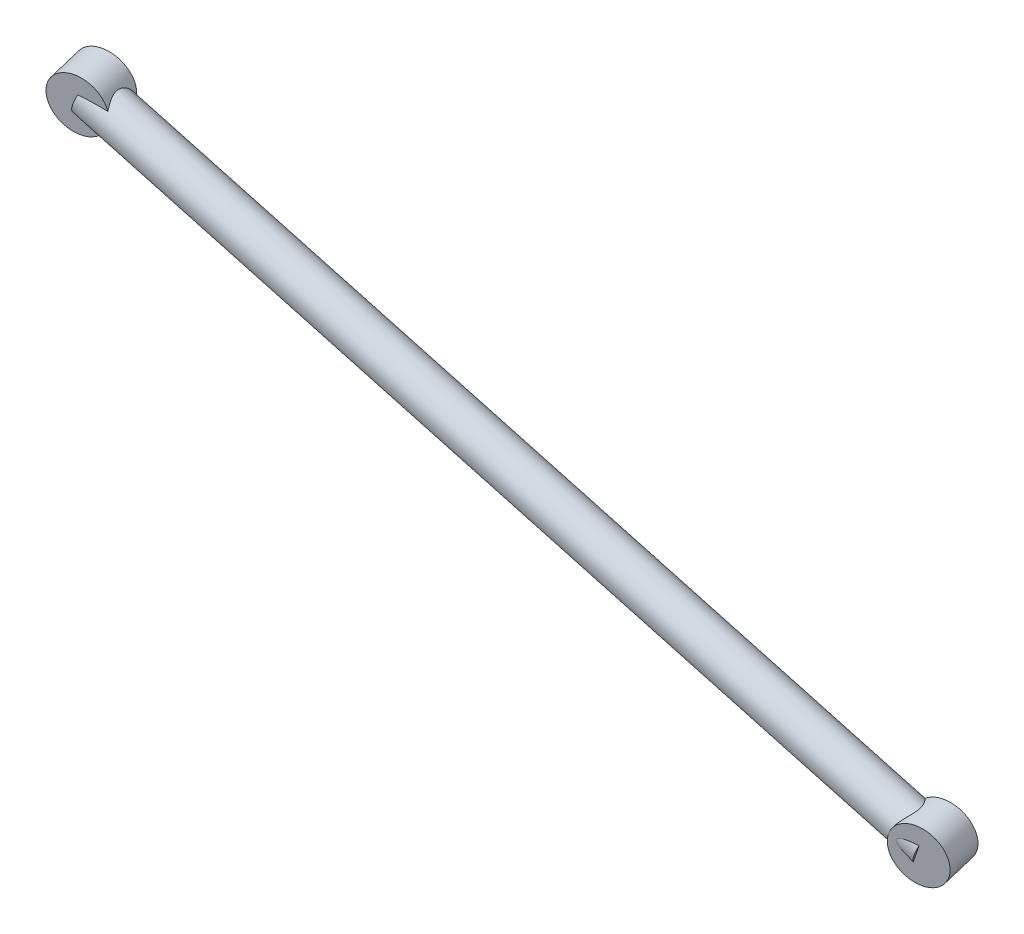
from build123d import *

# Parameters (mm, degrees)
SUSP_FR_TIE_ROD_PROFILE_R             = 8
SUSP_FR_TIE_ROD_ROD_END_IN_PROFILE_R  = 11
SUSP_FR_TIE_ROD_ROD_END_OUT_PROFILE_R = 11


with BuildPart() as part:
    # SUSP_FR_tie_rod: sweep along a curve in space
    with BuildLine() as susp_fr_tie_rod_path:
        Line((270, -90.4, -82.3915), (590.293517, -204.990503, -103.750386))
    # SUSP_FR_tie_rod profile (on start of the path) → SUSP_FR_tie_rod (sweep)
    with BuildSketch(Plane(origin=(270, -90.4, -82.3915), x_dir=(0.33685766905299525, 0.9415555803032463, 0), z_dir=(0.9397050891891743, -0.3361956240964046, -0.06266456487038859))):
        Circle(SUSP_FR_TIE_ROD_PROFILE_R)
    sweep(path=susp_fr_tie_rod_path.line)

    # SUSP_FR_tie_rod_rod_end_in: sweep along a curve in space
    with BuildLine() as susp_fr_tie_rod_rod_end_in_path:
        Line((271.21105, -91.0008904, -75.5232915), (268.78895, -89.7991096, -89.2597085))
    # SUSP_FR_tie_rod_rod_end_in profile (on start of the path) → SUSP_FR_tie_rod_rod_end_in (sweep)
    with BuildSketch(Plane(origin=(271.21105, -91.0008904, -75.5232915), x_dir=(-0.9848077644799927, 0, 0.17364811262987942), z_dir=(-0.17300714396088532, 0.08584148626193362, -0.9811726491167799))):
        Circle(SUSP_FR_TIE_ROD_ROD_END_IN_PROFILE_R)
    sweep(path=susp_fr_tie_rod_rod_end_in_path.line)

    # SUSP_FR_tie_rod_rod_end_out: sweep along a curve in space
    with BuildLine() as susp_fr_tie_rod_rod_end_out_path:
        Line((591.504567, -205.591393, -96.882177), (589.082466, -204.389612, -110.618594))
    # SUSP_FR_tie_rod_rod_end_out profile (on start of the path) → SUSP_FR_tie_rod_rod_end_out (sweep)
    with BuildSketch(Plane(origin=(591.504567, -205.591393, -96.882177), x_dir=(-0.9848077522197362, 0, 0.17364818216126232), z_dir=(-0.17300721303932562, 0.08584149938158056, -0.9811726357885688))):
        Circle(SUSP_FR_TIE_ROD_ROD_END_OUT_PROFILE_R)
    sweep(path=susp_fr_tie_rod_rod_end_out_path.line)


solid = part.part
